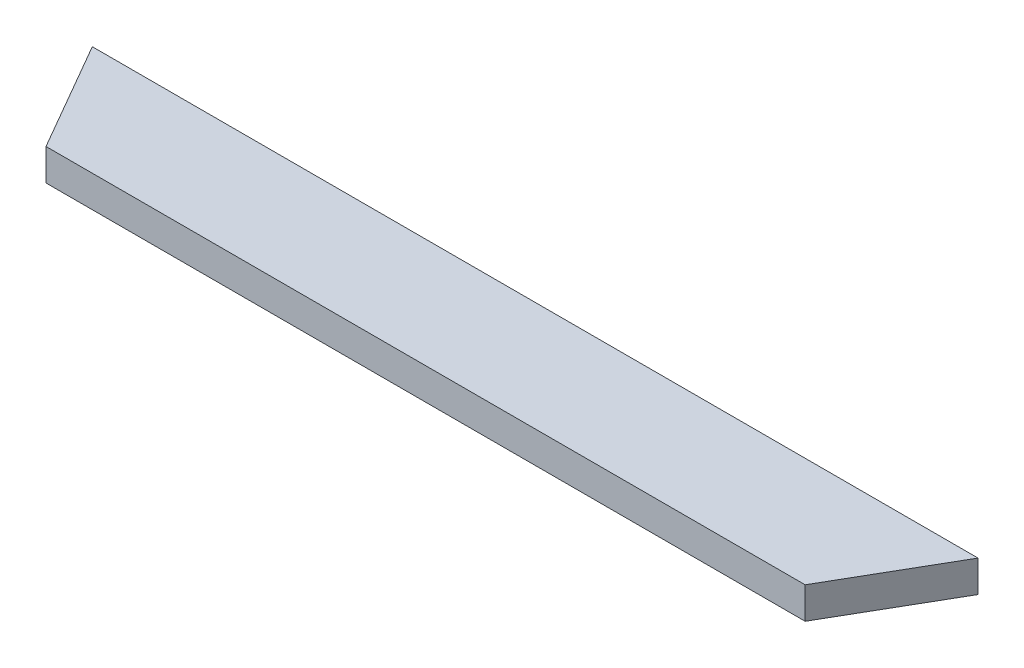
from build123d import *

# Parameters (mm, degrees)
BOSS_EXTRUDE1_DEPTH = 50


with BuildPart() as part:
    # Sketch1 → Boss-Extrude1 (new body)
    with BuildSketch(Plane(origin=(0, 0, 0), x_dir=(1, 0, 0), z_dir=(0, 1, 0))):
        Polygon((-600, 0), (600, 0), (700, 173.205080757), (-700, 173.205080757), align=None)
    extrude(amount=BOSS_EXTRUDE1_DEPTH)


solid = part.part
